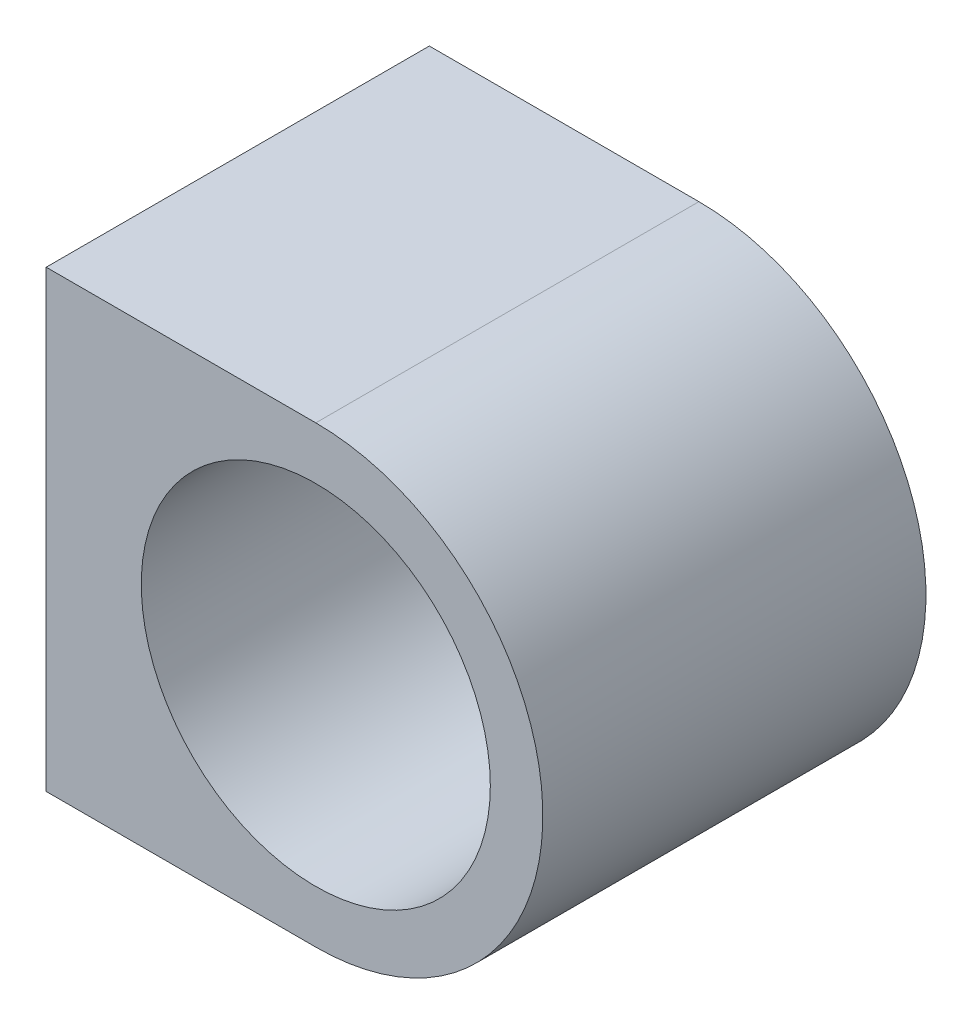
from build123d import *

# Parameters (mm, degrees)
SKETCH1_R                      = 6.15
BOSS_EXTRUDE1_DEPTH            = 13.5
F_2_7_2_7_DIAMETER_HOLE1_D     = 2.7
F_2_7_2_7_DIAMETER_HOLE1_DEPTH = 4
F_2_7_2_7_DIAMETER_HOLE1_TIP   = 0.811161836


with BuildPart() as part:
    # Sketch1 → Boss-Extrude1 (new body)
    with BuildSketch(Plane.XY):
        with BuildLine():
            Line((-9.5, 8), (-9.5, -8))
            Line((-9.5, -8), (0, -8))
            ThreePointArc((0, -8), (8, 0), (0, 8))
            Line((0, 8), (-9.5, 8))
        make_face()
        Circle(SKETCH1_R, mode=Mode.SUBTRACT)
    extrude(amount=BOSS_EXTRUDE1_DEPTH)

    # Ø2.7 (2.7) Diameter Hole1
    with Locations(Plane.ZY.offset(9.5)):
        with Locations((2.5, -5), (2.5, 5), (11, 5), (11, -5)):
            Hole(F_2_7_2_7_DIAMETER_HOLE1_D / 2, depth=F_2_7_2_7_DIAMETER_HOLE1_DEPTH)
            with Locations((0, 0, -(F_2_7_2_7_DIAMETER_HOLE1_DEPTH + F_2_7_2_7_DIAMETER_HOLE1_TIP / 2))):  # 118° drill point
                Cone(0, F_2_7_2_7_DIAMETER_HOLE1_D / 2, F_2_7_2_7_DIAMETER_HOLE1_TIP, mode=Mode.SUBTRACT)


solid = part.part
